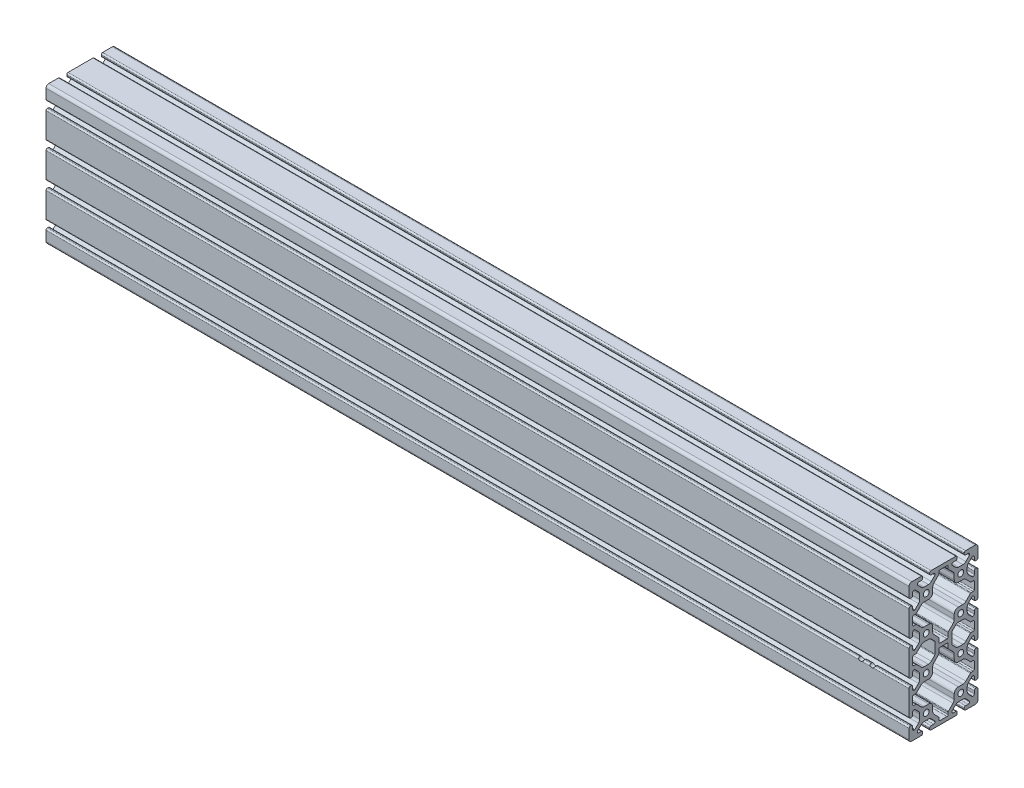
from build123d import *

# Parameters (mm, degrees)
SKETCH11_R                      = 3.4
F_40_40_8016_PROFILE_1_DEPTH    = 1000
M6X1_0_TAPPED_HOLE1_D           = 5
M6X1_0_TAPPED_HOLE1_DEPTH       = 30
M6X1_0_TAPPED_HOLE1_CSINK_D     = 6.05
M6X1_0_TAPPED_HOLE1_CSINK_ANGLE = 90
M6X1_0_TAPPED_HOLE1_TIP         = 1.502151548
CUT_EXTRUDE1_REACH              = 514.64
SKETCH12_R                      = 3.1


with BuildPart() as part:
    # Sketch11 → 40 40-8016 PROFILE(1) (new body)
    with BuildSketch(Plane(origin=(-500, 60, -20), x_dir=(0, 0, 1), z_dir=(1, 0, 0))):
        with BuildLine():
            Line((-18.43, 44.06), (-17.252, 44.06))
            ThreePointArc((-17.252, 44.06), (-16.141842354, 44.519842354), (-15.682, 45.63))
            Line((-15.682, 45.63), (-15.682, 48.715))
            ThreePointArc((-15.682, 48.715), (-15.222157646, 49.825157646), (-14.112, 50.285))
            Line((-14.112, 50.285), (-13.654503602, 50.285))
            ThreePointArc((-13.654503602, 50.285), (-13.363664194, 50.227148445), (-13.117102448, 50.062401154))
            Line((-13.117102448, 50.062401154), (-8.919842789, 45.865141495))
            ThreePointArc((-8.919842789, 45.865141495), (-7.890172221, 44.324130588), (-7.5286, 42.506384284))
            Line((-7.5286, 42.506384284), (-7.5286, 37.493615716))
            ThreePointArc((-7.5286, 37.493615716), (-7.890172221, 35.675869412), (-8.919842789, 34.134858505))
            Line((-8.919842789, 34.134858505), (-13.117102448, 29.937598846))
            ThreePointArc((-13.117102448, 29.937598846), (-13.363664194, 29.772851555), (-13.654503602, 29.715))
            Line((-13.654503602, 29.715), (-14.112, 29.715))
            ThreePointArc((-14.112, 29.715), (-15.222157646, 30.174842354), (-15.682, 31.285))
            Line((-15.682, 31.285), (-15.682, 34.37))
            ThreePointArc((-15.682, 34.37), (-16.141842354, 35.480157646), (-17.252, 35.94))
            Line((-17.252, 35.94), (-18.43, 35.94))
            ThreePointArc((-18.43, 35.94), (-19.540157646, 35.480157646), (-20, 34.37))
            Line((-20, 34.37), (-20, 5.63))
            ThreePointArc((-20, 5.63), (-19.540157646, 4.519842354), (-18.43, 4.06))
            Line((-18.43, 4.06), (-17.252, 4.06))
            ThreePointArc((-17.252, 4.06), (-16.141842354, 4.519842354), (-15.682, 5.63))
            Line((-15.682, 5.63), (-15.682, 8.715))
            ThreePointArc((-15.682, 8.715), (-15.222157646, 9.825157646), (-14.112, 10.285))
            Line((-14.112, 10.285), (-13.654503602, 10.285))
            ThreePointArc((-13.654503602, 10.285), (-13.363664194, 10.227148445), (-13.117102448, 10.062401154))
            Line((-13.117102448, 10.062401154), (-8.919842789, 5.865141495))
            ThreePointArc((-8.919842789, 5.865141495), (-7.890172221, 4.324130588), (-7.5286, 2.506384284))
            Line((-7.5286, 2.506384284), (-7.5286, -2.506384284))
            ThreePointArc((-7.5286, -2.506384284), (-7.890172221, -4.324130588), (-8.919842789, -5.865141495))
            Line((-8.919842789, -5.865141495), (-13.117102448, -10.062401154))
            ThreePointArc((-13.117102448, -10.062401154), (-13.363664194, -10.227148445), (-13.654503602, -10.285))
            Line((-13.654503602, -10.285), (-14.112, -10.285))
            ThreePointArc((-14.112, -10.285), (-15.222157646, -9.825157646), (-15.682, -8.715))
            Line((-15.682, -8.715), (-15.682, -5.63))
            ThreePointArc((-15.682, -5.63), (-16.141842354, -4.519842354), (-17.252, -4.06))
            Line((-17.252, -4.06), (-18.43, -4.06))
            ThreePointArc((-18.43, -4.06), (-19.540157646, -4.519842354), (-20, -5.63))
            Line((-20, -5.63), (-20, -16.83))
            ThreePointArc((-20, -16.83), (-19.071528496, -19.071528496), (-16.83, -20))
            Line((-16.83, -20), (-5.63, -20))
            ThreePointArc((-5.63, -20), (-4.519842354, -19.540157646), (-4.06, -18.43))
            Line((-4.06, -18.43), (-4.06, -17.252))
            ThreePointArc((-4.06, -17.252), (-4.519842354, -16.141842354), (-5.63, -15.682))
            Line((-5.63, -15.682), (-8.715, -15.682))
            ThreePointArc((-8.715, -15.682), (-9.825157646, -15.222157646), (-10.285, -14.112))
            Line((-10.285, -14.112), (-10.285, -13.654503602))
            ThreePointArc((-10.285, -13.654503602), (-10.227148445, -13.363664194), (-10.062401154, -13.117102448))
            Line((-10.062401154, -13.117102448), (-5.865141495, -8.919842789))
            ThreePointArc((-5.865141495, -8.919842789), (-4.324130588, -7.890172221), (-2.506384284, -7.5286))
            Line((-2.506384284, -7.5286), (2.506384284, -7.5286))
            ThreePointArc((2.506384284, -7.5286), (4.324130588, -7.890172221), (5.865141495, -8.919842789))
            Line((5.865141495, -8.919842789), (10.062401154, -13.117102448))
            ThreePointArc((10.062401154, -13.117102448), (10.227148445, -13.363664194), (10.285, -13.654503602))
            Line((10.285, -13.654503602), (10.285, -14.112))
            ThreePointArc((10.285, -14.112), (9.825157646, -15.222157646), (8.715, -15.682))
            Line((8.715, -15.682), (5.63, -15.682))
            ThreePointArc((5.63, -15.682), (4.519842354, -16.141842354), (4.06, -17.252))
            Line((4.06, -17.252), (4.06, -18.43))
            ThreePointArc((4.06, -18.43), (4.519842354, -19.540157646), (5.63, -20))
            Line((5.63, -20), (34.37, -20))
            ThreePointArc((34.37, -20), (35.480157646, -19.540157646), (35.94, -18.43))
            Line((35.94, -18.43), (35.94, -17.252))
            ThreePointArc((35.94, -17.252), (35.480157646, -16.141842354), (34.37, -15.682))
            Line((34.37, -15.682), (31.285, -15.682))
            ThreePointArc((31.285, -15.682), (30.174842354, -15.222157646), (29.715, -14.112))
            Line((29.715, -14.112), (29.715, -13.654503602))
            ThreePointArc((29.715, -13.654503602), (29.772851555, -13.363664194), (29.937598846, -13.117102448))
            Line((29.937598846, -13.117102448), (34.134858505, -8.919842789))
            ThreePointArc((34.134858505, -8.919842789), (35.675869412, -7.890172221), (37.493615716, -7.5286))
            Line((37.493615716, -7.5286), (42.506384284, -7.5286))
            ThreePointArc((42.506384284, -7.5286), (44.324130588, -7.890172221), (45.865141495, -8.919842789))
            Line((45.865141495, -8.919842789), (50.062401154, -13.117102448))
            ThreePointArc((50.062401154, -13.117102448), (50.227148445, -13.363664194), (50.285, -13.654503602))
            Line((50.285, -13.654503602), (50.285, -14.112))
            ThreePointArc((50.285, -14.112), (49.825157646, -15.222157646), (48.715, -15.682))
            Line((48.715, -15.682), (45.63, -15.682))
            ThreePointArc((45.63, -15.682), (44.519842354, -16.141842354), (44.06, -17.252))
            Line((44.06, -17.252), (44.06, -18.43))
            ThreePointArc((44.06, -18.43), (44.519842354, -19.540157646), (45.63, -20))
            Line((45.63, -20), (56.83, -20))
            ThreePointArc((56.83, -20), (59.071528496, -19.071528496), (60, -16.83))
            Line((60, -16.83), (60, -5.63))
            ThreePointArc((60, -5.63), (59.540157646, -4.519842354), (58.43, -4.06))
            Line((58.43, -4.06), (57.252, -4.06))
            ThreePointArc((57.252, -4.06), (56.141842354, -4.519842354), (55.682, -5.63))
            Line((55.682, -5.63), (55.682, -8.715))
            ThreePointArc((55.682, -8.715), (55.222157646, -9.825157646), (54.112, -10.285))
            Line((54.112, -10.285), (53.654503602, -10.285))
            ThreePointArc((53.654503602, -10.285), (53.363664194, -10.227148445), (53.117102448, -10.062401154))
            Line((53.117102448, -10.062401154), (48.919842789, -5.865141495))
            ThreePointArc((48.919842789, -5.865141495), (47.890172221, -4.324130588), (47.5286, -2.506384284))
            Line((47.5286, -2.506384284), (47.5286, 2.506384284))
            ThreePointArc((47.5286, 2.506384284), (47.890172221, 4.324130588), (48.919842789, 5.865141495))
            Line((48.919842789, 5.865141495), (53.117102448, 10.062401154))
            ThreePointArc((53.117102448, 10.062401154), (53.363664194, 10.227148445), (53.654503602, 10.285))
            Line((53.654503602, 10.285), (54.112, 10.285))
            ThreePointArc((54.112, 10.285), (55.222157646, 9.825157646), (55.682, 8.715))
            Line((55.682, 8.715), (55.682, 5.63))
            ThreePointArc((55.682, 5.63), (56.141842354, 4.519842354), (57.252, 4.06))
            Line((57.252, 4.06), (58.43, 4.06))
            ThreePointArc((58.43, 4.06), (59.540157646, 4.519842354), (60, 5.63))
            Line((60, 5.63), (60, 34.37))
            ThreePointArc((60, 34.37), (59.540157646, 35.480157646), (58.43, 35.94))
            Line((58.43, 35.94), (57.252, 35.94))
            ThreePointArc((57.252, 35.94), (56.141842354, 35.480157646), (55.682, 34.37))
            Line((55.682, 34.37), (55.682, 31.285))
            ThreePointArc((55.682, 31.285), (55.222157646, 30.174842354), (54.112, 29.715))
            Line((54.112, 29.715), (53.654503602, 29.715))
            ThreePointArc((53.654503602, 29.715), (53.363664194, 29.772851555), (53.117102448, 29.937598846))
            Line((53.117102448, 29.937598846), (48.919842789, 34.134858505))
            ThreePointArc((48.919842789, 34.134858505), (47.890172221, 35.675869412), (47.5286, 37.493615716))
            Line((47.5286, 37.493615716), (47.5286, 42.506384284))
            ThreePointArc((47.5286, 42.506384284), (47.890172221, 44.324130588), (48.919842789, 45.865141495))
            Line((48.919842789, 45.865141495), (53.117102448, 50.062401154))
            ThreePointArc((53.117102448, 50.062401154), (53.363664194, 50.227148445), (53.654503602, 50.285))
            Line((53.654503602, 50.285), (54.112, 50.285))
            ThreePointArc((54.112, 50.285), (55.222157646, 49.825157646), (55.682, 48.715))
            Line((55.682, 48.715), (55.682, 45.63))
            ThreePointArc((55.682, 45.63), (56.141842354, 44.519842354), (57.252, 44.06))
            Line((57.252, 44.06), (58.43, 44.06))
            ThreePointArc((58.43, 44.06), (59.540157646, 44.519842354), (60, 45.63))
            Line((60, 45.63), (60, 74.37))
            ThreePointArc((60, 74.37), (59.540157646, 75.480157646), (58.43, 75.94))
            Line((58.43, 75.94), (57.252, 75.94))
            ThreePointArc((57.252, 75.94), (56.141842354, 75.480157646), (55.682, 74.37))
            Line((55.682, 74.37), (55.682, 71.285))
            ThreePointArc((55.682, 71.285), (55.222157646, 70.174842354), (54.112, 69.715))
            Line((54.112, 69.715), (53.654503602, 69.715))
            ThreePointArc((53.654503602, 69.715), (53.363664194, 69.772851555), (53.117102448, 69.937598846))
            Line((53.117102448, 69.937598846), (48.919842789, 74.134858505))
            ThreePointArc((48.919842789, 74.134858505), (47.890172221, 75.675869412), (47.5286, 77.493615716))
            Line((47.5286, 77.493615716), (47.5286, 82.506384284))
            ThreePointArc((47.5286, 82.506384284), (47.890172221, 84.324130588), (48.919842789, 85.865141495))
            Line((48.919842789, 85.865141495), (53.117102448, 90.062401154))
            ThreePointArc((53.117102448, 90.062401154), (53.363664194, 90.227148445), (53.654503602, 90.285))
            Line((53.654503602, 90.285), (54.112, 90.285))
            ThreePointArc((54.112, 90.285), (55.222157646, 89.825157646), (55.682, 88.715))
            Line((55.682, 88.715), (55.682, 85.63))
            ThreePointArc((55.682, 85.63), (56.141842354, 84.519842354), (57.252, 84.06))
            Line((57.252, 84.06), (58.43, 84.06))
            ThreePointArc((58.43, 84.06), (59.540157646, 84.519842354), (60, 85.63))
            Line((60, 85.63), (60, 114.37))
            ThreePointArc((60, 114.37), (59.540157646, 115.480157646), (58.43, 115.94))
            Line((58.43, 115.94), (57.252, 115.94))
            ThreePointArc((57.252, 115.94), (56.141842354, 115.480157646), (55.682, 114.37))
            Line((55.682, 114.37), (55.682, 111.285))
            ThreePointArc((55.682, 111.285), (55.222157646, 110.174842354), (54.112, 109.715))
            Line((54.112, 109.715), (53.654503602, 109.715))
            ThreePointArc((53.654503602, 109.715), (53.363664194, 109.772851555), (53.117102448, 109.937598846))
            Line((53.117102448, 109.937598846), (48.919842789, 114.134858505))
            ThreePointArc((48.919842789, 114.134858505), (47.890172221, 115.675869412), (47.5286, 117.493615716))
            Line((47.5286, 117.493615716), (47.5286, 122.506384284))
            ThreePointArc((47.5286, 122.506384284), (47.890172221, 124.324130588), (48.919842789, 125.865141495))
            Line((48.919842789, 125.865141495), (53.117102448, 130.062401154))
            ThreePointArc((53.117102448, 130.062401154), (53.363664194, 130.227148445), (53.654503602, 130.285))
            Line((53.654503602, 130.285), (54.112, 130.285))
            ThreePointArc((54.112, 130.285), (55.222157646, 129.825157646), (55.682, 128.715))
            Line((55.682, 128.715), (55.682, 125.63))
            ThreePointArc((55.682, 125.63), (56.141842354, 124.519842354), (57.252, 124.06))
            Line((57.252, 124.06), (58.43, 124.06))
            ThreePointArc((58.43, 124.06), (59.540157646, 124.519842354), (60, 125.63))
            Line((60, 125.63), (60, 136.83))
            ThreePointArc((60, 136.83), (59.071528496, 139.071528496), (56.83, 140))
            Line((56.83, 140), (45.63, 140))
            ThreePointArc((45.63, 140), (44.519842354, 139.540157646), (44.06, 138.43))
            Line((44.06, 138.43), (44.06, 137.252))
            ThreePointArc((44.06, 137.252), (44.519842354, 136.141842354), (45.63, 135.682))
            Line((45.63, 135.682), (48.715, 135.682))
            ThreePointArc((48.715, 135.682), (49.825157646, 135.222157646), (50.285, 134.112))
            Line((50.285, 134.112), (50.285, 133.654503602))
            ThreePointArc((50.285, 133.654503602), (50.227148445, 133.363664194), (50.062401154, 133.117102448))
            Line((50.062401154, 133.117102448), (45.865141495, 128.919842789))
            ThreePointArc((45.865141495, 128.919842789), (44.324130588, 127.890172221), (42.506384284, 127.5286))
            Line((42.506384284, 127.5286), (37.493615716, 127.5286))
            ThreePointArc((37.493615716, 127.5286), (35.675869412, 127.890172221), (34.134858505, 128.919842789))
            Line((34.134858505, 128.919842789), (29.937598846, 133.117102448))
            ThreePointArc((29.937598846, 133.117102448), (29.772851555, 133.363664194), (29.715, 133.654503602))
            Line((29.715, 133.654503602), (29.715, 134.112))
            ThreePointArc((29.715, 134.112), (30.174842354, 135.222157646), (31.285, 135.682))
            Line((31.285, 135.682), (34.37, 135.682))
            ThreePointArc((34.37, 135.682), (35.480157646, 136.141842354), (35.94, 137.252))
            Line((35.94, 137.252), (35.94, 138.43))
            ThreePointArc((35.94, 138.43), (35.480157646, 139.540157646), (34.37, 140))
            Line((34.37, 140), (5.63, 140))
            ThreePointArc((5.63, 140), (4.519842354, 139.540157646), (4.06, 138.43))
            Line((4.06, 138.43), (4.06, 137.252))
            ThreePointArc((4.06, 137.252), (4.519842354, 136.141842354), (5.63, 135.682))
            Line((5.63, 135.682), (8.715, 135.682))
            ThreePointArc((8.715, 135.682), (9.825157646, 135.222157646), (10.285, 134.112))
            Line((10.285, 134.112), (10.285, 133.654503602))
            ThreePointArc((10.285, 133.654503602), (10.227148445, 133.363664194), (10.062401154, 133.117102448))
            Line((10.062401154, 133.117102448), (5.865141495, 128.919842789))
            ThreePointArc((5.865141495, 128.919842789), (4.324130588, 127.890172221), (2.506384284, 127.5286))
            Line((2.506384284, 127.5286), (-2.506384284, 127.5286))
            ThreePointArc((-2.506384284, 127.5286), (-4.324130588, 127.890172221), (-5.865141495, 128.919842789))
            Line((-5.865141495, 128.919842789), (-10.062401154, 133.117102448))
            ThreePointArc((-10.062401154, 133.117102448), (-10.227148445, 133.363664194), (-10.285, 133.654503602))
            Line((-10.285, 133.654503602), (-10.285, 134.112))
            ThreePointArc((-10.285, 134.112), (-9.825157646, 135.222157646), (-8.715, 135.682))
            Line((-8.715, 135.682), (-5.63, 135.682))
            ThreePointArc((-5.63, 135.682), (-4.519842354, 136.141842354), (-4.06, 137.252))
            Line((-4.06, 137.252), (-4.06, 138.43))
            ThreePointArc((-4.06, 138.43), (-4.519842354, 139.540157646), (-5.63, 140))
            Line((-5.63, 140), (-16.83, 140))
            ThreePointArc((-16.83, 140), (-19.071528496, 139.071528496), (-20, 136.83))
            Line((-20, 136.83), (-20, 125.63))
            ThreePointArc((-20, 125.63), (-19.540157646, 124.519842354), (-18.43, 124.06))
            Line((-18.43, 124.06), (-17.252, 124.06))
            ThreePointArc((-17.252, 124.06), (-16.141842354, 124.519842354), (-15.682, 125.63))
            Line((-15.682, 125.63), (-15.682, 128.715))
            ThreePointArc((-15.682, 128.715), (-15.222157646, 129.825157646), (-14.112, 130.285))
            Line((-14.112, 130.285), (-13.654503602, 130.285))
            ThreePointArc((-13.654503602, 130.285), (-13.363664194, 130.227148445), (-13.117102448, 130.062401154))
            Line((-13.117102448, 130.062401154), (-8.919842789, 125.865141495))
            ThreePointArc((-8.919842789, 125.865141495), (-7.890172221, 124.324130588), (-7.5286, 122.506384284))
            Line((-7.5286, 122.506384284), (-7.5286, 117.493615716))
            ThreePointArc((-7.5286, 117.493615716), (-7.890172221, 115.675869412), (-8.919842789, 114.134858505))
            Line((-8.919842789, 114.134858505), (-13.117102448, 109.937598846))
            ThreePointArc((-13.117102448, 109.937598846), (-13.363664194, 109.772851555), (-13.654503602, 109.715))
            Line((-13.654503602, 109.715), (-14.112, 109.715))
            ThreePointArc((-14.112, 109.715), (-15.222157646, 110.174842354), (-15.682, 111.285))
            Line((-15.682, 111.285), (-15.682, 114.37))
            ThreePointArc((-15.682, 114.37), (-16.141842354, 115.480157646), (-17.252, 115.94))
            Line((-17.252, 115.94), (-18.43, 115.94))
            ThreePointArc((-18.43, 115.94), (-19.540157646, 115.480157646), (-20, 114.37))
            Line((-20, 114.37), (-20, 85.63))
            ThreePointArc((-20, 85.63), (-19.540157646, 84.519842354), (-18.43, 84.06))
            Line((-18.43, 84.06), (-17.252, 84.06))
            ThreePointArc((-17.252, 84.06), (-16.141842354, 84.519842354), (-15.682, 85.63))
            Line((-15.682, 85.63), (-15.682, 88.715))
            ThreePointArc((-15.682, 88.715), (-15.222157646, 89.825157646), (-14.112, 90.285))
            Line((-14.112, 90.285), (-13.654503602, 90.285))
            ThreePointArc((-13.654503602, 90.285), (-13.363664194, 90.227148445), (-13.117102448, 90.062401154))
            Line((-13.117102448, 90.062401154), (-8.919842789, 85.865141495))
            ThreePointArc((-8.919842789, 85.865141495), (-7.890172221, 84.324130588), (-7.5286, 82.506384284))
            Line((-7.5286, 82.506384284), (-7.5286, 77.493615716))
            ThreePointArc((-7.5286, 77.493615716), (-7.890172221, 75.675869412), (-8.919842789, 74.134858505))
            Line((-8.919842789, 74.134858505), (-13.117102448, 69.937598846))
            ThreePointArc((-13.117102448, 69.937598846), (-13.363664194, 69.772851555), (-13.654503602, 69.715))
            Line((-13.654503602, 69.715), (-14.112, 69.715))
            ThreePointArc((-14.112, 69.715), (-15.222157646, 70.174842354), (-15.682, 71.285))
            Line((-15.682, 71.285), (-15.682, 74.37))
            ThreePointArc((-15.682, 74.37), (-16.141842354, 75.480157646), (-17.252, 75.94))
            Line((-17.252, 75.94), (-18.43, 75.94))
            ThreePointArc((-18.43, 75.94), (-19.540157646, 75.480157646), (-20, 74.37))
            Line((-20, 74.37), (-20, 45.63))
            ThreePointArc((-20, 45.63), (-19.540157646, 44.519842354), (-18.43, 44.06))
        make_face()
        with Locations((40, 0)):
            Circle(SKETCH11_R, mode=Mode.SUBTRACT)
        with Locations((40, 40)):
            Circle(SKETCH11_R, mode=Mode.SUBTRACT)
        Circle(SKETCH11_R, mode=Mode.SUBTRACT)
        with Locations((0, 40)):
            Circle(SKETCH11_R, mode=Mode.SUBTRACT)
        with Locations((40, 80)):
            Circle(SKETCH11_R, mode=Mode.SUBTRACT)
        with Locations((40, 120)):
            Circle(SKETCH11_R, mode=Mode.SUBTRACT)
        with Locations((0, 80)):
            Circle(SKETCH11_R, mode=Mode.SUBTRACT)
        with Locations((0, 120)):
            Circle(SKETCH11_R, mode=Mode.SUBTRACT)
        with BuildLine():
            Line((10.285, 66.134247481), (10.285, 53.865752519))
            ThreePointArc((10.285, 53.865752519), (10.188327006, 53.37974456), (9.913025612, 52.967726907))
            Line((9.913025612, 52.967726907), (5.865141495, 48.919842789))
            ThreePointArc((5.865141495, 48.919842789), (4.324130588, 47.890172221), (2.506384284, 47.5286))
            Line((2.506384284, 47.5286), (-2.506384284, 47.5286))
            ThreePointArc((-2.506384284, 47.5286), (-4.324130588, 47.890172221), (-5.865141495, 48.919842789))
            Line((-5.865141495, 48.919842789), (-11.178324317, 54.233025612))
            ThreePointArc((-11.178324317, 54.233025612), (-11.59034197, 54.508327006), (-12.076349929, 54.605))
            Line((-12.076349929, 54.605), (-14.41, 54.605))
            ThreePointArc((-14.41, 54.605), (-15.308025612, 54.976974388), (-15.68, 55.875))
            Line((-15.68, 55.875), (-15.68, 64.125))
            ThreePointArc((-15.68, 64.125), (-15.308025612, 65.023025612), (-14.41, 65.395))
            Line((-14.41, 65.395), (-12.076349929, 65.395))
            ThreePointArc((-12.076349929, 65.395), (-11.59034197, 65.491672994), (-11.178324317, 65.766974388))
            Line((-11.178324317, 65.766974388), (-5.865141495, 71.080157211))
            ThreePointArc((-5.865141495, 71.080157211), (-4.324130588, 72.109827779), (-2.506384284, 72.4714))
            Line((-2.506384284, 72.4714), (2.506384284, 72.4714))
            ThreePointArc((2.506384284, 72.4714), (4.324130588, 72.109827779), (5.865141495, 71.080157211))
            Line((5.865141495, 71.080157211), (9.913025612, 67.032273093))
            ThreePointArc((9.913025612, 67.032273093), (10.188327006, 66.62025544), (10.285, 66.134247481))
        make_face(mode=Mode.SUBTRACT)
        with BuildLine():
            Line((25.395, 67.923650071), (25.395, 63.43))
            ThreePointArc((25.395, 63.43), (25.023025612, 62.531974388), (24.125, 62.16))
            Line((24.125, 62.16), (15.875, 62.16))
            ThreePointArc((15.875, 62.16), (14.976974388, 62.531974388), (14.605, 63.43))
            Line((14.605, 63.43), (14.605, 67.923650071))
            ThreePointArc((14.605, 67.923650071), (14.508327006, 68.40965803), (14.233025612, 68.821675683))
            Line((14.233025612, 68.821675683), (8.919842789, 74.134858505))
            ThreePointArc((8.919842789, 74.134858505), (7.890172221, 75.675869412), (7.5286, 77.493615716))
            Line((7.5286, 77.493615716), (7.5286, 82.7786))
            ThreePointArc((7.5286, 82.7786), (6.137357211, 86.137357211), (2.7786, 87.5286))
            Line((2.7786, 87.5286), (-2.506384284, 87.5286))
            ThreePointArc((-2.506384284, 87.5286), (-4.324130588, 87.890172221), (-5.865141495, 88.919842789))
            Line((-5.865141495, 88.919842789), (-11.178324317, 94.233025612))
            ThreePointArc((-11.178324317, 94.233025612), (-11.59034197, 94.508327006), (-12.076349929, 94.605))
            Line((-12.076349929, 94.605), (-14.41, 94.605))
            ThreePointArc((-14.41, 94.605), (-15.308025612, 94.976974388), (-15.68, 95.875))
            Line((-15.68, 95.875), (-15.68, 104.125))
            ThreePointArc((-15.68, 104.125), (-15.308025612, 105.023025612), (-14.41, 105.395))
            Line((-14.41, 105.395), (-12.076349929, 105.395))
            ThreePointArc((-12.076349929, 105.395), (-11.59034197, 105.491672994), (-11.178324317, 105.766974388))
            Line((-11.178324317, 105.766974388), (-5.865141495, 111.080157211))
            ThreePointArc((-5.865141495, 111.080157211), (-4.324130588, 112.109827779), (-2.506384284, 112.4714))
            Line((-2.506384284, 112.4714), (2.7786, 112.4714))
            ThreePointArc((2.7786, 112.4714), (6.137357211, 113.862642789), (7.5286, 117.2214))
            Line((7.5286, 117.2214), (7.5286, 122.506384284))
            ThreePointArc((7.5286, 122.506384284), (7.890172221, 124.324130588), (8.919842789, 125.865141495))
            Line((8.919842789, 125.865141495), (14.233025612, 131.178324317))
            ThreePointArc((14.233025612, 131.178324317), (14.508327006, 131.59034197), (14.605, 132.076349929))
            Line((14.605, 132.076349929), (14.605, 134.41))
            ThreePointArc((14.605, 134.41), (14.976974388, 135.308025612), (15.875, 135.68))
            Line((15.875, 135.68), (24.125, 135.68))
            ThreePointArc((24.125, 135.68), (25.023025612, 135.308025612), (25.395, 134.41))
            Line((25.395, 134.41), (25.395, 132.076349929))
            ThreePointArc((25.395, 132.076349929), (25.491672994, 131.59034197), (25.766974388, 131.178324317))
            Line((25.766974388, 131.178324317), (31.080157211, 125.865141495))
            ThreePointArc((31.080157211, 125.865141495), (32.109827779, 124.324130588), (32.4714, 122.506384284))
            Line((32.4714, 122.506384284), (32.4714, 117.2214))
            ThreePointArc((32.4714, 117.2214), (33.862642789, 113.862642789), (37.2214, 112.4714))
            Line((37.2214, 112.4714), (42.506384284, 112.4714))
            ThreePointArc((42.506384284, 112.4714), (44.324130588, 112.109827779), (45.865141495, 111.080157211))
            Line((45.865141495, 111.080157211), (51.178324317, 105.766974388))
            ThreePointArc((51.178324317, 105.766974388), (51.59034197, 105.491672994), (52.076349929, 105.395))
            Line((52.076349929, 105.395), (54.41, 105.395))
            ThreePointArc((54.41, 105.395), (55.308025612, 105.023025612), (55.68, 104.125))
            Line((55.68, 104.125), (55.68, 95.875))
            ThreePointArc((55.68, 95.875), (55.308025612, 94.976974388), (54.41, 94.605))
            Line((54.41, 94.605), (52.076349929, 94.605))
            ThreePointArc((52.076349929, 94.605), (51.59034197, 94.508327006), (51.178324317, 94.233025612))
            Line((51.178324317, 94.233025612), (45.865141495, 88.919842789))
            ThreePointArc((45.865141495, 88.919842789), (44.324130588, 87.890172221), (42.506384284, 87.5286))
            Line((42.506384284, 87.5286), (37.2214, 87.5286))
            ThreePointArc((37.2214, 87.5286), (33.862642789, 86.137357211), (32.4714, 82.7786))
            Line((32.4714, 82.7786), (32.4714, 77.493615716))
            ThreePointArc((32.4714, 77.493615716), (32.109827779, 75.675869412), (31.080157211, 74.134858505))
            Line((31.080157211, 74.134858505), (25.766974388, 68.821675683))
            ThreePointArc((25.766974388, 68.821675683), (25.491672994, 68.40965803), (25.395, 67.923650071))
        make_face(mode=Mode.SUBTRACT)
        with BuildLine():
            Line((30.086974388, 67.032273093), (34.134858505, 71.080157211))
            ThreePointArc((34.134858505, 71.080157211), (35.675869412, 72.109827779), (37.493615716, 72.4714))
            Line((37.493615716, 72.4714), (42.506384284, 72.4714))
            ThreePointArc((42.506384284, 72.4714), (44.324130588, 72.109827779), (45.865141495, 71.080157211))
            Line((45.865141495, 71.080157211), (51.178324317, 65.766974388))
            ThreePointArc((51.178324317, 65.766974388), (51.59034197, 65.491672994), (52.076349929, 65.395))
            Line((52.076349929, 65.395), (54.41, 65.395))
            ThreePointArc((54.41, 65.395), (55.308025612, 65.023025612), (55.68, 64.125))
            Line((55.68, 64.125), (55.68, 55.875))
            ThreePointArc((55.68, 55.875), (55.308025612, 54.976974388), (54.41, 54.605))
            Line((54.41, 54.605), (52.076349929, 54.605))
            ThreePointArc((52.076349929, 54.605), (51.59034197, 54.508327006), (51.178324317, 54.233025612))
            Line((51.178324317, 54.233025612), (45.865141495, 48.919842789))
            ThreePointArc((45.865141495, 48.919842789), (44.324130588, 47.890172221), (42.506384284, 47.5286))
            Line((42.506384284, 47.5286), (37.493615716, 47.5286))
            ThreePointArc((37.493615716, 47.5286), (35.675869412, 47.890172221), (34.134858505, 48.919842789))
            Line((34.134858505, 48.919842789), (30.086974388, 52.967726907))
            ThreePointArc((30.086974388, 52.967726907), (29.811672994, 53.37974456), (29.715, 53.865752519))
            Line((29.715, 53.865752519), (29.715, 66.134247481))
            ThreePointArc((29.715, 66.134247481), (29.811672994, 66.62025544), (30.086974388, 67.032273093))
        make_face(mode=Mode.SUBTRACT)
        with BuildLine():
            Line((25.395, 56.57), (25.395, 52.076349929))
            ThreePointArc((25.395, 52.076349929), (25.491672994, 51.59034197), (25.766974388, 51.178324317))
            Line((25.766974388, 51.178324317), (31.080157211, 45.865141495))
            ThreePointArc((31.080157211, 45.865141495), (32.109827779, 44.324130588), (32.4714, 42.506384284))
            Line((32.4714, 42.506384284), (32.4714, 37.2214))
            ThreePointArc((32.4714, 37.2214), (33.862642789, 33.862642789), (37.2214, 32.4714))
            Line((37.2214, 32.4714), (42.506384284, 32.4714))
            ThreePointArc((42.506384284, 32.4714), (44.324130588, 32.109827779), (45.865141495, 31.080157211))
            Line((45.865141495, 31.080157211), (51.178324317, 25.766974388))
            ThreePointArc((51.178324317, 25.766974388), (51.59034197, 25.491672994), (52.076349929, 25.395))
            Line((52.076349929, 25.395), (54.41, 25.395))
            ThreePointArc((54.41, 25.395), (55.308025612, 25.023025612), (55.68, 24.125))
            Line((55.68, 24.125), (55.68, 15.875))
            ThreePointArc((55.68, 15.875), (55.308025612, 14.976974388), (54.41, 14.605))
            Line((54.41, 14.605), (52.076349929, 14.605))
            ThreePointArc((52.076349929, 14.605), (51.59034197, 14.508327006), (51.178324317, 14.233025612))
            Line((51.178324317, 14.233025612), (45.865141495, 8.919842789))
            ThreePointArc((45.865141495, 8.919842789), (44.324130588, 7.890172221), (42.506384284, 7.5286))
            Line((42.506384284, 7.5286), (37.2214, 7.5286))
            ThreePointArc((37.2214, 7.5286), (33.862642789, 6.137357211), (32.4714, 2.7786))
            Line((32.4714, 2.7786), (32.4714, -2.506384284))
            ThreePointArc((32.4714, -2.506384284), (32.109827779, -4.324130588), (31.080157211, -5.865141495))
            Line((31.080157211, -5.865141495), (25.766974388, -11.178324317))
            ThreePointArc((25.766974388, -11.178324317), (25.491672994, -11.59034197), (25.395, -12.076349929))
            Line((25.395, -12.076349929), (25.395, -14.41))
            ThreePointArc((25.395, -14.41), (25.023025612, -15.308025612), (24.125, -15.68))
            Line((24.125, -15.68), (15.875, -15.68))
            ThreePointArc((15.875, -15.68), (14.976974388, -15.308025612), (14.605, -14.41))
            Line((14.605, -14.41), (14.605, -12.076349929))
            ThreePointArc((14.605, -12.076349929), (14.508327006, -11.59034197), (14.233025612, -11.178324317))
            Line((14.233025612, -11.178324317), (8.919842789, -5.865141495))
            ThreePointArc((8.919842789, -5.865141495), (7.890172221, -4.324130588), (7.5286, -2.506384284))
            Line((7.5286, -2.506384284), (7.5286, 2.7786))
            ThreePointArc((7.5286, 2.7786), (6.137357211, 6.137357211), (2.7786, 7.5286))
            Line((2.7786, 7.5286), (-2.506384284, 7.5286))
            ThreePointArc((-2.506384284, 7.5286), (-4.324130588, 7.890172221), (-5.865141495, 8.919842789))
            Line((-5.865141495, 8.919842789), (-11.178324317, 14.233025612))
            ThreePointArc((-11.178324317, 14.233025612), (-11.59034197, 14.508327006), (-12.076349929, 14.605))
            Line((-12.076349929, 14.605), (-14.41, 14.605))
            ThreePointArc((-14.41, 14.605), (-15.308025612, 14.976974388), (-15.68, 15.875))
            Line((-15.68, 15.875), (-15.68, 24.125))
            ThreePointArc((-15.68, 24.125), (-15.308025612, 25.023025612), (-14.41, 25.395))
            Line((-14.41, 25.395), (-12.076349929, 25.395))
            ThreePointArc((-12.076349929, 25.395), (-11.59034197, 25.491672994), (-11.178324317, 25.766974388))
            Line((-11.178324317, 25.766974388), (-5.865141495, 31.080157211))
            ThreePointArc((-5.865141495, 31.080157211), (-4.324130588, 32.109827779), (-2.506384284, 32.4714))
            Line((-2.506384284, 32.4714), (2.7786, 32.4714))
            ThreePointArc((2.7786, 32.4714), (6.137357211, 33.862642789), (7.5286, 37.2214))
            Line((7.5286, 37.2214), (7.5286, 42.506384284))
            ThreePointArc((7.5286, 42.506384284), (7.890172221, 44.324130588), (8.919842789, 45.865141495))
            Line((8.919842789, 45.865141495), (14.233025612, 51.178324317))
            ThreePointArc((14.233025612, 51.178324317), (14.508327006, 51.59034197), (14.605, 52.076349929))
            Line((14.605, 52.076349929), (14.605, 56.57))
            ThreePointArc((14.605, 56.57), (14.976974388, 57.468025612), (15.875, 57.84))
            Line((15.875, 57.84), (24.125, 57.84))
            ThreePointArc((24.125, 57.84), (25.023025612, 57.468025612), (25.395, 56.57))
        make_face(mode=Mode.SUBTRACT)
    extrude(amount=F_40_40_8016_PROFILE_1_DEPTH)

    # M6x1.0 Tapped Hole1
    with Locations(Plane.XY.offset(40)):
        with Locations((457, 23), (444, 23), (457, -23), (444, -23)):
            CounterSinkHole(M6X1_0_TAPPED_HOLE1_D / 2, M6X1_0_TAPPED_HOLE1_CSINK_D / 2, depth=M6X1_0_TAPPED_HOLE1_DEPTH, counter_sink_angle=M6X1_0_TAPPED_HOLE1_CSINK_ANGLE)
            with Locations((0, 0, -(M6X1_0_TAPPED_HOLE1_DEPTH + M6X1_0_TAPPED_HOLE1_TIP / 2))):  # 118° drill point
                Cone(0, M6X1_0_TAPPED_HOLE1_D / 2, M6X1_0_TAPPED_HOLE1_TIP, mode=Mode.SUBTRACT)

    # Cut-Extrude1: up to this face of the body (flat: up to its plane)
    cut_extrude1_end = Plane(part.part.faces().sort_by_distance((0, 27.1725, 35.682))[0])
    # Sketch12 → Cut-Extrude1 (cut, up to the picked face)
    with BuildSketch(Plane.XY.offset(40), mode=Mode.PRIVATE) as cut_extrude1_sk1:
        with Locations((457, 23)):
            Circle(SKETCH12_R)
    cut_extrude1_tool1 = split(extrude(cut_extrude1_sk1.sketch, amount=-CUT_EXTRUDE1_REACH, mode=Mode.PRIVATE), bisect_by=cut_extrude1_end, keep=Keep.BOTH, mode=Mode.PRIVATE)
    # Sketch12 → Cut-Extrude1 (cut, up to the picked face)
    with BuildSketch(Plane.XY.offset(40), mode=Mode.PRIVATE) as cut_extrude1_sk2:
        with Locations((444, 23)):
            Circle(SKETCH12_R)
    cut_extrude1_tool2 = split(extrude(cut_extrude1_sk2.sketch, amount=-CUT_EXTRUDE1_REACH, mode=Mode.PRIVATE), bisect_by=cut_extrude1_end, keep=Keep.BOTH, mode=Mode.PRIVATE)
    # Sketch12 → Cut-Extrude1 (cut, up to the picked face)
    with BuildSketch(Plane.XY.offset(40), mode=Mode.PRIVATE) as cut_extrude1_sk3:
        with Locations((444, -23)):
            Circle(SKETCH12_R)
    cut_extrude1_tool3 = split(extrude(cut_extrude1_sk3.sketch, amount=-CUT_EXTRUDE1_REACH, mode=Mode.PRIVATE), bisect_by=cut_extrude1_end, keep=Keep.BOTH, mode=Mode.PRIVATE)
    # Sketch12 → Cut-Extrude1 (cut, up to the picked face)
    with BuildSketch(Plane.XY.offset(40), mode=Mode.PRIVATE) as cut_extrude1_sk4:
        with Locations((457, -23)):
            Circle(SKETCH12_R)
    cut_extrude1_tool4 = split(extrude(cut_extrude1_sk4.sketch, amount=-CUT_EXTRUDE1_REACH, mode=Mode.PRIVATE), bisect_by=cut_extrude1_end, keep=Keep.BOTH, mode=Mode.PRIVATE)
    add(cut_extrude1_tool1.solids().sort_by(Axis((457, 23, 40), (0, 0, -1)))[0], mode=Mode.SUBTRACT)
    add(cut_extrude1_tool2.solids().sort_by(Axis((444, 23, 40), (0, 0, -1)))[0], mode=Mode.SUBTRACT)
    add(cut_extrude1_tool3.solids().sort_by(Axis((444, -23, 40), (0, 0, -1)))[0], mode=Mode.SUBTRACT)
    add(cut_extrude1_tool4.solids().sort_by(Axis((457, -23, 40), (0, 0, -1)))[0], mode=Mode.SUBTRACT)


solid = part.part
